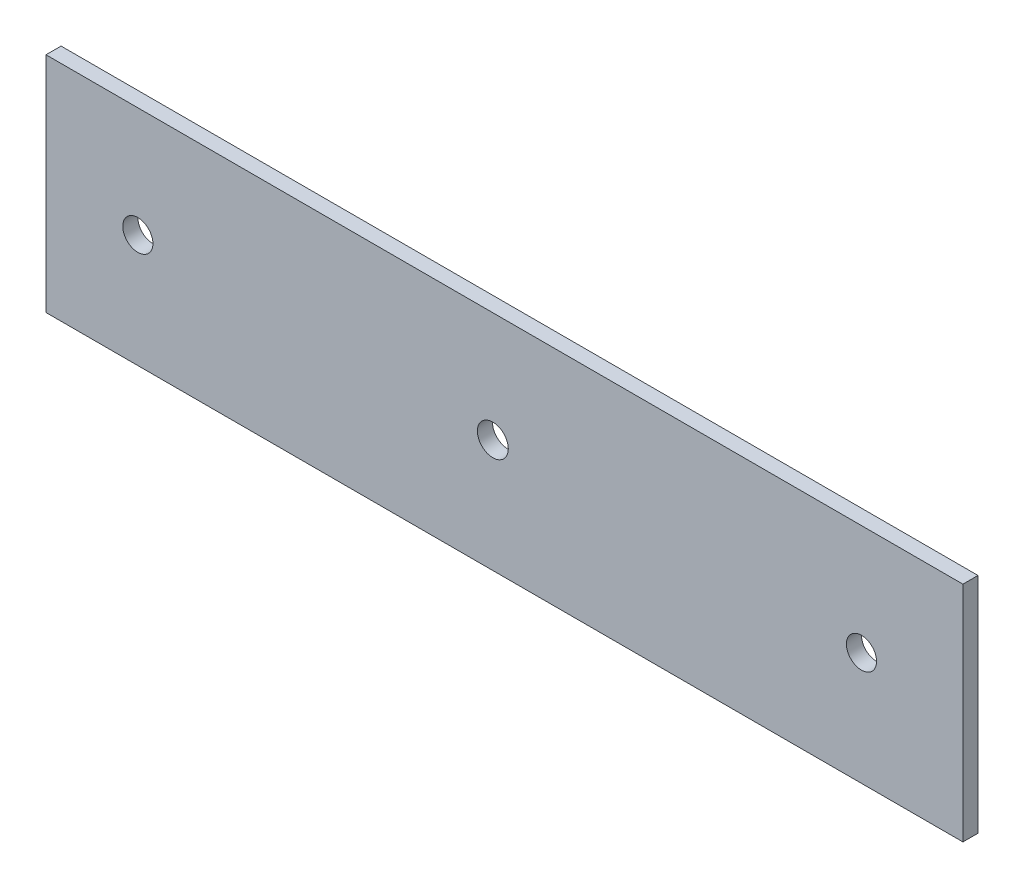
from build123d import *

# Parameters (mm, degrees)
SKETCH1_W           = 193.103670403
SKETCH1_H           = 47.018427379
SKETCH1_R           = 3.175
SKETCH1_R_2         = 3.2512
BOSS_EXTRUDE1_DEPTH = 3.175


with BuildPart() as part:
    # Sketch1 → Boss-Extrude1 (new body)
    with BuildSketch(Plane.XY):
        with Locations((153.410147032, -0.317071457)):
            Rectangle(SKETCH1_W, SKETCH1_H)
        with Locations((76.2, 0)):
            Circle(SKETCH1_R, mode=Mode.SUBTRACT)
        with Locations((228.6, 0)):
            Circle(SKETCH1_R, mode=Mode.SUBTRACT)
        with Locations((150.964022252, 0)):
            Circle(SKETCH1_R_2, mode=Mode.SUBTRACT)
    extrude(amount=BOSS_EXTRUDE1_DEPTH)


solid = part.part
